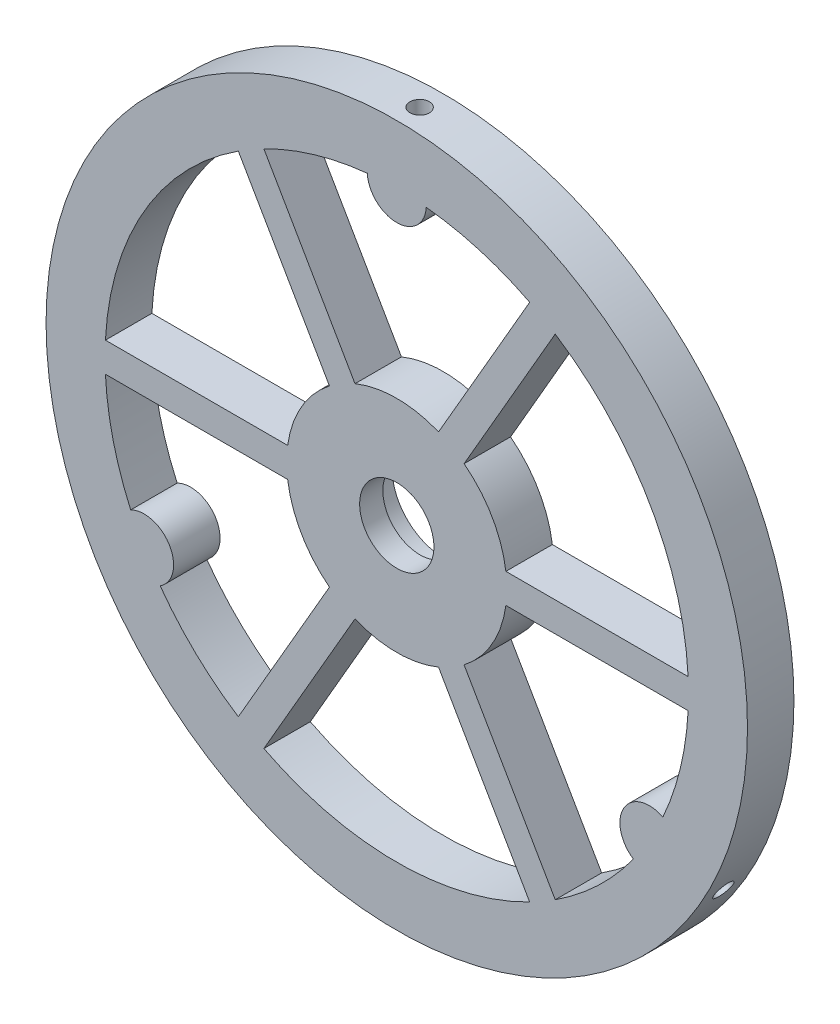
from build123d import *

# Parameters (mm, degrees)
SKETCH1_R           = 75.5
BOSS_EXTRUDE1_DEPTH = 10
CUT_EXTRUDE1_START  = -10
SKETCH2_R           = 11
CUT_EXTRUDE1_DEPTH  = 5
SKETCH3_R           = 8
CUT_EXTRUDE2_DEPTH  = 107.890130508
SKETCH5_R           = 2.0828
CUT_EXTRUDE4_DEPTH  = 12.7
CIRPATTERN2_COUNT   = 3
CUT_EXTRUDE5_DEPTH  = 108.240384344
CIRPATTERN3_COUNT   = 6
CUT_EXTRUDE6_DEPTH  = 108.240384344
CIRPATTERN4_COUNT   = 3


with BuildPart() as part:
    # Sketch1 → Boss-Extrude1 (new body)
    with BuildSketch(Plane.XY):
        Circle(SKETCH1_R)
    extrude(amount=BOSS_EXTRUDE1_DEPTH)

    # Sketch2 → Cut-Extrude1 (cut)
    with BuildSketch(Plane.XY.offset(10).offset(CUT_EXTRUDE1_START)):
        Circle(SKETCH2_R)
    extrude(amount=CUT_EXTRUDE1_DEPTH, mode=Mode.SUBTRACT)

    # Sketch3 → Cut-Extrude2 (cut, through all)
    with BuildSketch(Plane(origin=(0, 0, 5), x_dir=(-1, 0, 0), z_dir=(0, 0, -1))):
        Circle(SKETCH3_R)
    extrude(amount=-CUT_EXTRUDE2_DEPTH, mode=Mode.SUBTRACT)

    # Sketch5 → Cut-Extrude4 (cut)
    with BuildSketch(Plane(origin=(0, 75.5, 0), x_dir=(1, 0, 0), z_dir=(0, 1, 0))):
        with Locations(Location((0, -5.08, 0), (0, 0, 270))):
            Circle(SKETCH5_R)
    cut_extrude4 = extrude(amount=-CUT_EXTRUDE4_DEPTH, mode=Mode.SUBTRACT)

    # CirPattern2: Cut-Extrude4 ×3 about axis
    cirpattern2_axis = Axis((0, 0, 0), (0, 0, 1))
    for i in range(1, CIRPATTERN2_COUNT):
        add(cut_extrude4.rotate(cirpattern2_axis, i * 360 / CIRPATTERN2_COUNT), mode=Mode.SUBTRACT)

    # Sketch6 → Cut-Extrude5 (cut, through all)
    with BuildSketch(Plane(origin=(0, 0, 0), x_dir=(-1, 0, 0), z_dir=(0, 0, -1))):
        with BuildLine():
            Line((-25.430689936, 50.397247041), (-8.993552206, 21.927289361))
            ThreePointArc((-8.993552206, 21.927289361), (0, 23.7), (8.993552206, 21.927289361))
            Line((8.993552206, 21.927289361), (25.430689936, 50.397247041))
            ThreePointArc((25.430689936, 50.397247041), (13.070537583, 54.915968054), (3.6e-08, 56.45))
            ThreePointArc((3.6e-08, 56.45), (-13.070537548, 54.915968062), (-25.430689936, 50.397247041))
        make_face()
        with BuildLine():
            ThreePointArc((3.6e-08, 56.45), (13.070537583, 54.915968054), (25.430689936, 50.397247041))
            Line((25.430689936, 50.397247041), (28.61021379, 55.9043439))
            ThreePointArc((28.61021379, 55.9043439), (17.78253642, 60.229738489), (6.341879371, 62.478960987))
            ThreePointArc((6.341879371, 62.478960987), (4.375151569, 58.197766982), (3.6e-08, 56.45))
        make_face()
        with BuildLine():
            Line((-28.61021379, 55.9043439), (-25.430689936, 50.397247041))
            ThreePointArc((-25.430689936, 50.397247041), (-13.070537548, 54.915968062), (3.6e-08, 56.45))
            ThreePointArc((3.6e-08, 56.45), (-4.375151542, 58.197766957), (-6.341879371, 62.478960987))
            ThreePointArc((-6.341879371, 62.478960987), (-17.78253642, 60.229738489), (-28.61021379, 55.9043439))
        make_face()
    cut_extrude5 = extrude(amount=-CUT_EXTRUDE5_DEPTH, mode=Mode.SUBTRACT)

    # CirPattern3: Cut-Extrude5 ×6 about axis
    cirpattern3_axis = Axis((0, 0, 0), (0, 0, 1))
    for i in range(1, CIRPATTERN3_COUNT):
        add(cut_extrude5.rotate(cirpattern3_axis, i * 360 / CIRPATTERN3_COUNT), mode=Mode.SUBTRACT)

    # Sketch8 → Cut-Extrude6 (cut, through all)
    with BuildSketch(Plane(origin=(0, 0, 0), x_dir=(-1, 0, 0), z_dir=(0, 0, -1))):
        with BuildLine():
            ThreePointArc((-57.279307102, 25.747251851), (-48.887134044, 28.225), (-50.937427732, 36.731709136))
            ThreePointArc((-50.937427732, 36.731709136), (-54.386395358, 31.4), (-57.279307102, 25.747251851))
        make_face()
    cut_extrude6 = extrude(amount=-CUT_EXTRUDE6_DEPTH, mode=Mode.SUBTRACT)

    # CirPattern4: Cut-Extrude6 ×3 about axis
    cirpattern4_axis = Axis((0, 0, 5), (0, 0, -1))
    for i in range(1, CIRPATTERN4_COUNT):
        add(cut_extrude6.rotate(cirpattern4_axis, i * 360 / CIRPATTERN4_COUNT), mode=Mode.SUBTRACT)


solid = part.part
